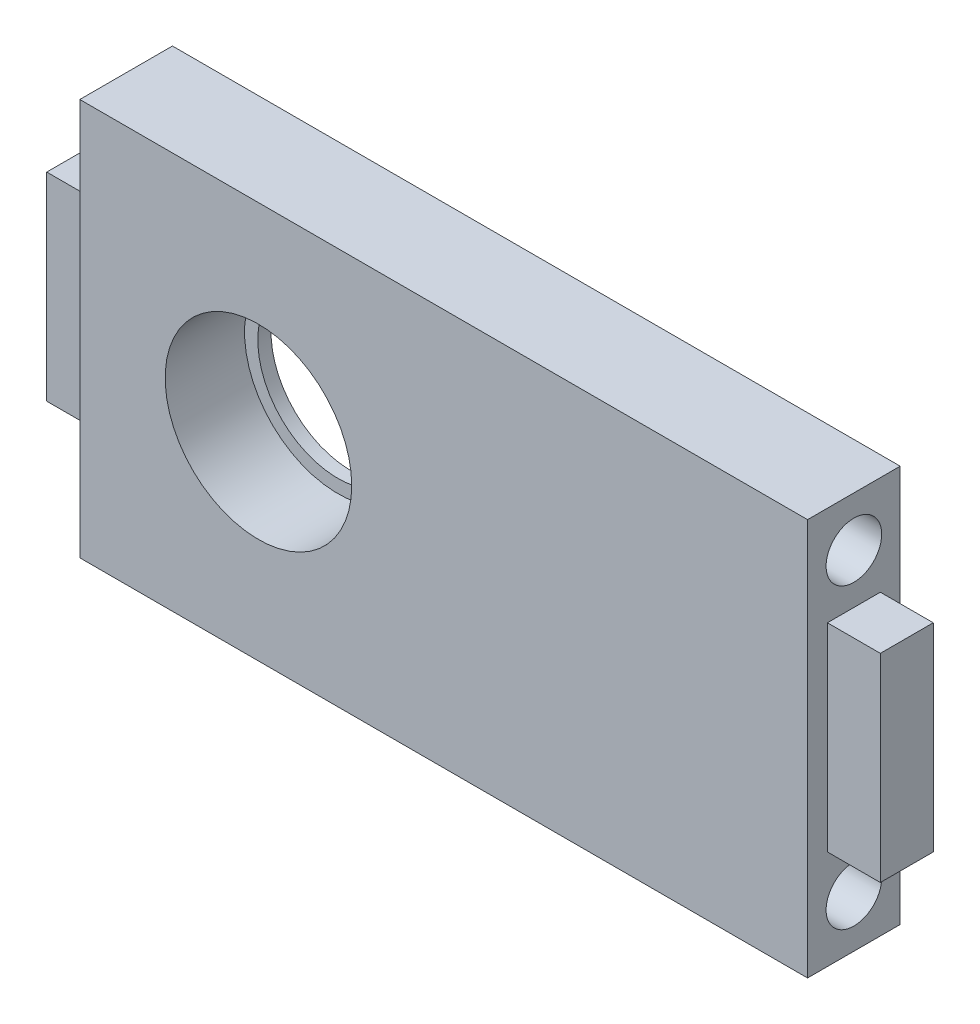
from build123d import *

# Parameters (mm, degrees)
SKETCH_1_W          = 55
SKETCH_1_H          = 30
SKETCH_1_R          = 7.05
EXTRUDE_1_DEPTH     = 7
SKETCH_2_R          = 7.05
SKETCH_2_R_2        = 6.05
EXTRUDE_2_DEPTH     = 1
EXTRUDE_START       = 1.5
SKETCH_3_W          = 4
SKETCH_3_H          = 15
EXTRUDE_3_DEPTH     = 4
SKETCH_4_R          = 2.1
CUT_EXTRUDE_1_DEPTH = 6


with BuildPart() as part:
    # Эскиз1 → Бобышка-Вытянуть1 (new body)
    with BuildSketch(Plane.XY):
        Rectangle(SKETCH_1_W, SKETCH_1_H)
        with Locations((-14, 0)):
            Circle(SKETCH_1_R, mode=Mode.SUBTRACT)
    extrude(amount=EXTRUDE_1_DEPTH)

    # Эскиз2 → Бобышка-Вытянуть2 (add)
    with BuildSketch(Plane.XY):
        with Locations((-14, 0)):
            Circle(SKETCH_2_R)
        with Locations((-14, 0)):
            Circle(SKETCH_2_R_2, mode=Mode.SUBTRACT)
    extrude(amount=EXTRUDE_2_DEPTH)

    # Эскиз3 → Бобышка-Вытянуть3 (add)
    with BuildSketch(Plane.XY.offset(EXTRUDE_START)):
        with Locations((29.5, 0)):
            Rectangle(SKETCH_3_W, SKETCH_3_H)
        with Locations((-29.5, 0)):
            Rectangle(SKETCH_3_W, SKETCH_3_H)
    extrude(amount=EXTRUDE_3_DEPTH)

    # Эскиз4 → Вырез-Вытянуть1 (cut)
    with BuildSketch(Plane(origin=(27.5, 0, 0), x_dir=(0, 0, -1), z_dir=(1, 0, 0))):
        with Locations((-3.5, 11.25)):
            Circle(SKETCH_4_R)
        with Locations(Location((-3.5, -11.25, 0), (0, 0, 180))):
            Circle(SKETCH_4_R)
    cut_extrude_1 = extrude(amount=-CUT_EXTRUDE_1_DEPTH, mode=Mode.SUBTRACT)

    # Зеркальное отражение1: Вырез-Вытянуть1 across plane
    add(cut_extrude_1.mirror(Plane(origin=(0, 0, 0), x_dir=(0, 0, 1), z_dir=(1, 0, 0))), mode=Mode.SUBTRACT)


solid = part.part
